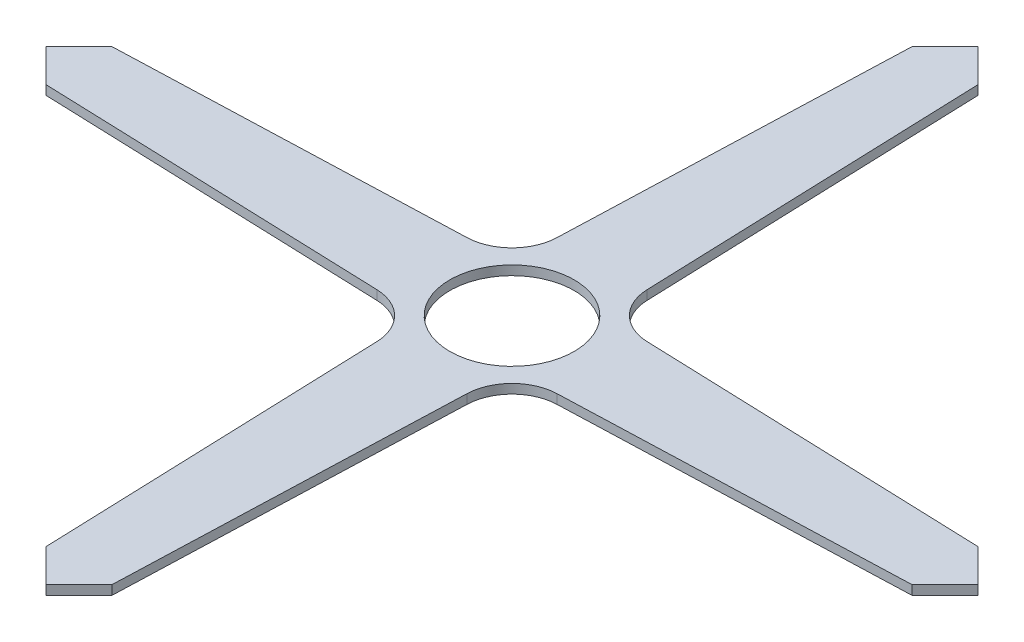
from build123d import *

# Parameters (mm, degrees)
SKETCH1_R           = 20
BOSS_EXTRUDE1_DEPTH = 3
FILLET1_R           = 15


with BuildPart() as part:
    # Sketch1 → Boss-Extrude1 (new body)
    with BuildSketch(Plane(origin=(0, 0, 0), x_dir=(1, 0, 0), z_dir=(0, 1, 0))):
        Polygon((-286.26, 15), (-410.653398282, 10.606601718), (-421.26, 0), (-410.653398282, -10.606601718), (-286.26, -15), (-281.866601718, -139.393398282), (-271.26, -150), (-260.653398282, -139.393398282), (-256.26, -15), (-131.866601718, -10.606601718), (-121.26, 0), (-131.866601718, 10.606601718), (-256.26, 15), (-260.653398282, 139.393398282), (-271.26, 150), (-281.866601718, 139.393398282), align=None)
        with Locations(Location((-271.26, 0, 0), (0, 0, 270))):
            Circle(SKETCH1_R, mode=Mode.SUBTRACT)
    extrude(amount=BOSS_EXTRUDE1_DEPTH)

    # Fillet1
    fillet1_edges = [part.edges().sort_by_distance(p)[0] for p in [
        (-256.26, 1.5, -15),
        (-256.26, 1.5, 15),
        (-286.26, 1.5, 15),
        (-286.26, 1.5, -15),
    ]]
    fillet(fillet1_edges, radius=FILLET1_R)


solid = part.part
